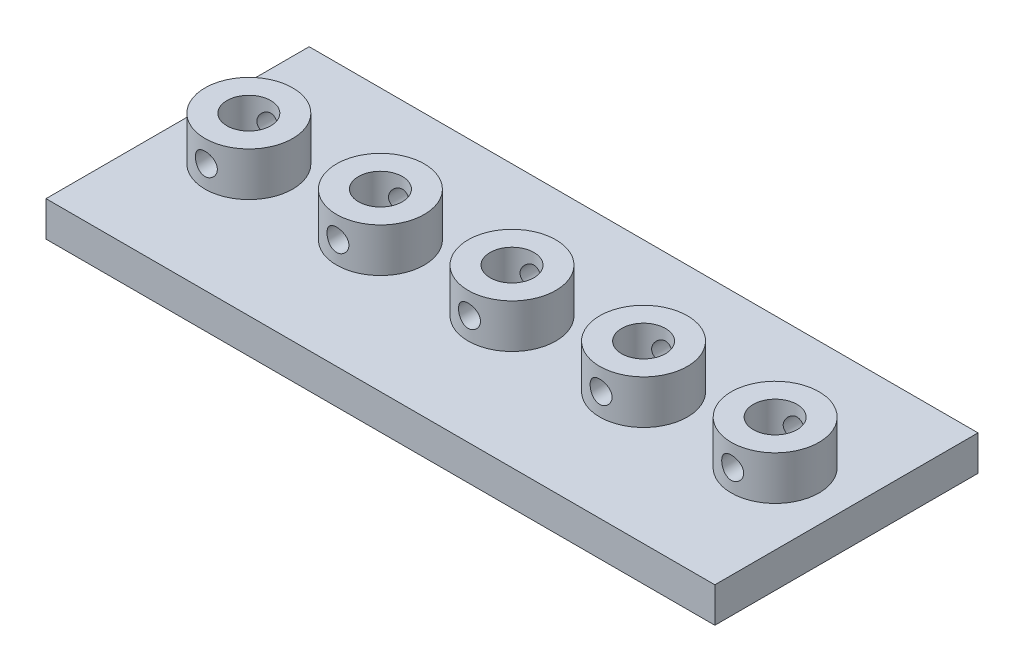
from build123d import *

# Parameters (mm, degrees)
SKETCH1_W               = 30.5
SKETCH1_H               = 12
BOSS_EXTRUDE1_DEPTH     = 1.6
SKETCH2_R               = 2
SKETCH2_R_2             = 1
BOSS_EXTRUDE2_DEPTH     = 2
CUT_EXTRUDE1_DEPTH      = 2
CUT_EXTRUDE1_DEPTH_BACK = 2
SKETCH3_R               = 0.5


with BuildPart() as part:
    # Sketch1 → Boss-Extrude1 (new body)
    with BuildSketch(Plane(origin=(0, 0, 0), x_dir=(1, 0, 0), z_dir=(0, 1, 0))):
        Rectangle(SKETCH1_W, SKETCH1_H)
    extrude(amount=BOSS_EXTRUDE1_DEPTH)

    # Sketch2 → Boss-Extrude2 (add)
    # profile 1 of 5: a face of its own
    with BuildSketch(Plane(origin=(0, 1.6, 0), x_dir=(1, 0, 0), z_dir=(0, 1, 0))):
        with Locations(Location((0, 0, 0), (0, 0, 270))):
            Circle(SKETCH2_R)
        with Locations(Location((0, 0, 0), (0, 0, 270))):
            Circle(SKETCH2_R_2, mode=Mode.SUBTRACT)
    # profile 2 of 5: a face of its own
    with BuildSketch(Plane(origin=(0, 1.6, 0), x_dir=(1, 0, 0), z_dir=(0, 1, 0))):
        with Locations(Location((6, 0, 0), (0, 0, 270))):
            Circle(SKETCH2_R)
        with Locations(Location((6, 0, 0), (0, 0, 270))):
            Circle(SKETCH2_R_2, mode=Mode.SUBTRACT)
    # profile 3 of 5: a face of its own
    with BuildSketch(Plane(origin=(0, 1.6, 0), x_dir=(1, 0, 0), z_dir=(0, 1, 0))):
        with Locations(Location((12, 0, 0), (0, 0, 270))):
            Circle(SKETCH2_R)
        with Locations(Location((12, 0, 0), (0, 0, 270))):
            Circle(SKETCH2_R_2, mode=Mode.SUBTRACT)
    # profile 4 of 5: a face of its own
    with BuildSketch(Plane(origin=(0, 1.6, 0), x_dir=(1, 0, 0), z_dir=(0, 1, 0))):
        with Locations(Location((-6, 0, 0), (0, 0, 270))):
            Circle(SKETCH2_R)
        with Locations(Location((-6, 0, 0), (0, 0, 270))):
            Circle(SKETCH2_R_2, mode=Mode.SUBTRACT)
    # profile 5 of 5: a face of its own
    with BuildSketch(Plane(origin=(0, 1.6, 0), x_dir=(1, 0, 0), z_dir=(0, 1, 0))):
        with Locations(Location((-12, 0, 0), (0, 0, 270))):
            Circle(SKETCH2_R)
        with Locations(Location((-12, 0, 0), (0, 0, 270))):
            Circle(SKETCH2_R_2, mode=Mode.SUBTRACT)
    extrude(amount=BOSS_EXTRUDE2_DEPTH)

    # Sketch3 → Cut-Extrude1 (cut, two sides: drawn at the far end of the back side and taken through both)
    with BuildSketch(Plane.XY.offset(-CUT_EXTRUDE1_DEPTH_BACK)):
        with Locations(Location((-12, 2.6, 0), (0, 0, 270.000000002))):
            Circle(SKETCH3_R)
        with Locations(Location((-6, 2.6, 0), (0, 0, 270.000000002))):
            Circle(SKETCH3_R)
        with Locations(Location((0, 2.6, 0), (0, 0, 270.000000002))):
            Circle(SKETCH3_R)
        with Locations(Location((6, 2.6, 0), (0, 0, 270.000000002))):
            Circle(SKETCH3_R)
        with Locations(Location((12, 2.6, 0), (0, 0, 270.000000002))):
            Circle(SKETCH3_R)
    extrude(amount=CUT_EXTRUDE1_DEPTH + CUT_EXTRUDE1_DEPTH_BACK, mode=Mode.SUBTRACT)


solid = part.part
